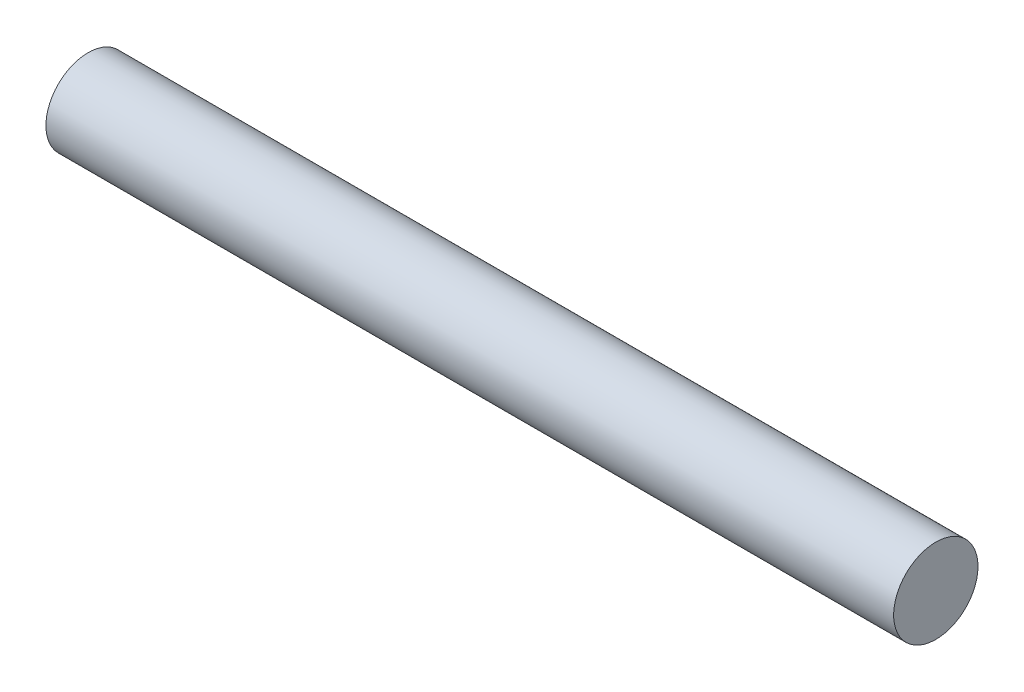
from build123d import *

# Parameters (mm, degrees)
SKETCH1_R           = 3
BOSS_EXTRUDE1_DEPTH = 60.29999878


with BuildPart() as part:
    # Sketch1 → Boss-Extrude1 (new body)
    with BuildSketch(Plane(origin=(0, 0, 0), x_dir=(0, 0, -1), z_dir=(1, 0, 0))):
        Circle(SKETCH1_R)
    extrude(amount=BOSS_EXTRUDE1_DEPTH)


solid = part.part
